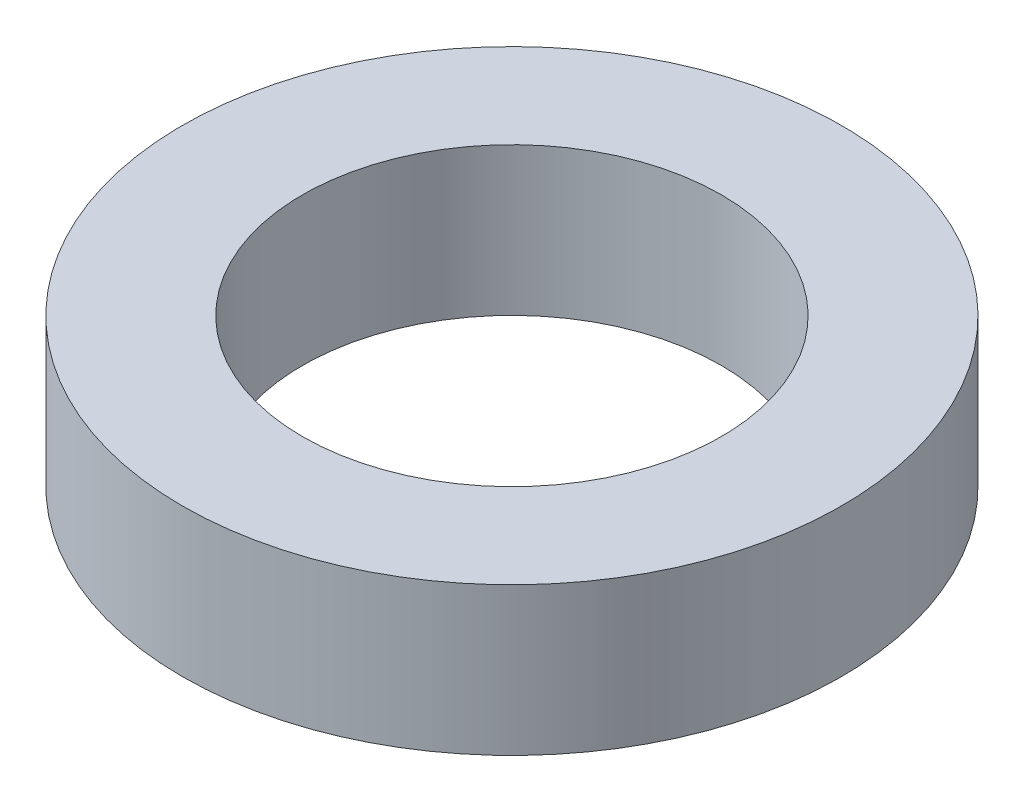
from build123d import *

# Parameters (mm, degrees)
SKETCH1_R           = 5.35
SKETCH1_R_2         = 3.4
BOSS_EXTRUDE1_DEPTH = 2.4


with BuildPart() as part:
    # Sketch1 → Boss-Extrude1 (new body)
    with BuildSketch(Plane(origin=(0, 0, 0), x_dir=(1, 0, 0), z_dir=(0, 1, 0))):
        with Locations(Location((0, 0, 0), (0, 0, 270))):
            Circle(SKETCH1_R)
        with Locations(Location((0, 0, 0), (0, 0, 270))):
            Circle(SKETCH1_R_2, mode=Mode.SUBTRACT)
    extrude(amount=BOSS_EXTRUDE1_DEPTH)


solid = part.part
